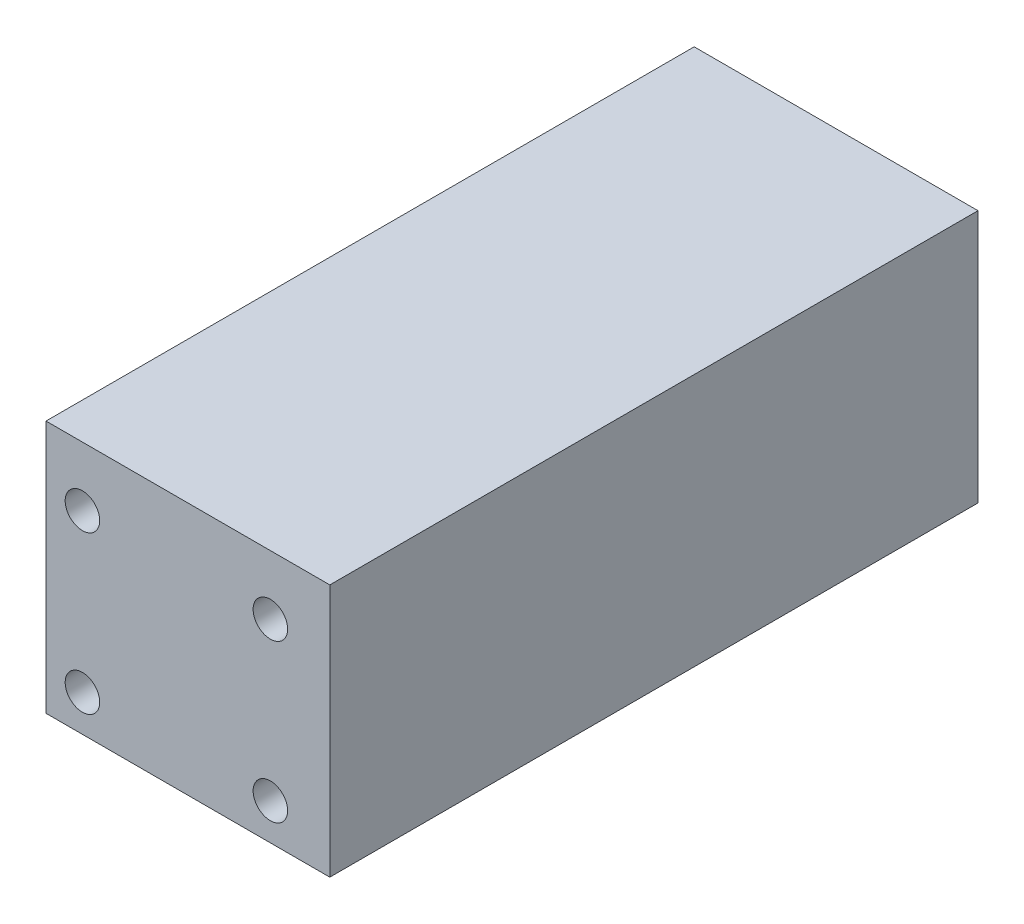
from build123d import *

# Parameters (mm, degrees)
SKETCH1_W           = 34
SKETCH1_H           = 30
SKETCH1_R           = 2.25
BOSS_EXTRUDE1_DEPTH = 5
SKETCH2_W           = 5
SKETCH2_H           = 30
BOSS_EXTRUDE2_DEPTH = 15
SKETCH4_W           = 5
SKETCH4_H           = 30
BOSS_EXTRUDE3_DEPTH = 25
SKETCH5_R           = 2.5
CUT_EXTRUDE1_DEPTH  = 25
SKETCH6_W           = 15
SKETCH6_H           = 30
CUT_EXTRUDE2_DEPTH  = 66
SKETCH7_W           = 34
SKETCH7_H           = 30
SKETCH7_R           = 2.25
BOSS_EXTRUDE4_DEPTH = 79.5
SKETCH8_W           = 34
SKETCH8_H           = 74.5
CUT_EXTRUDE3_DEPTH  = 30
BOSS_EXTRUDE6_DEPTH = 84.5


with BuildPart() as part:
    # Sketch1 → Boss-Extrude1 (new body)
    with BuildSketch(Plane.XY):
        with Locations((17, 15)):
            Rectangle(SKETCH1_W, SKETCH1_H)
        with Locations((4.75, 25.25)):
            Circle(SKETCH1_R, mode=Mode.SUBTRACT)
        with Locations((29.25, 25.25)):
            Circle(SKETCH1_R, mode=Mode.SUBTRACT)
        with Locations((29.25, 4.75)):
            Circle(SKETCH1_R, mode=Mode.SUBTRACT)
        with Locations((4.75, 4.75)):
            Circle(SKETCH1_R, mode=Mode.SUBTRACT)
    extrude(amount=BOSS_EXTRUDE1_DEPTH)

    # Sketch2 → Boss-Extrude2 (add)
    with BuildSketch(Plane.ZY):
        with Locations((2.5, 15)):
            Rectangle(SKETCH2_W, SKETCH2_H)
    extrude(amount=BOSS_EXTRUDE2_DEPTH)

    # Sketch4 → Boss-Extrude3 (add)
    with BuildSketch(Plane.XY.offset(5)):
        with Locations((-12.5, 15)):
            Rectangle(SKETCH4_W, SKETCH4_H)
    extrude(amount=BOSS_EXTRUDE3_DEPTH)

    # Sketch5 → Cut-Extrude1 (cut)
    with BuildSketch(Plane(origin=(-10, 0, 0), x_dir=(0, 0, -1), z_dir=(1, 0, 0))):
        with Locations((-24, 15)):
            Circle(SKETCH5_R)
        with Locations((-10, 15)):
            Circle(SKETCH5_R)
    extrude(amount=-CUT_EXTRUDE1_DEPTH, mode=Mode.SUBTRACT)

    # Sketch6 → Cut-Extrude2 (cut)
    with BuildSketch(Plane(origin=(0, 30, 0), x_dir=(1, 0, 0), z_dir=(0, 1, 0))):
        with Locations((-7.5, -15)):
            Rectangle(SKETCH6_W, SKETCH6_H)
    extrude(amount=-CUT_EXTRUDE2_DEPTH, mode=Mode.SUBTRACT)

    # Sketch7 → Boss-Extrude4 (add)
    with BuildSketch(Plane.XY.offset(5)):
        with Locations((17, 15)):
            Rectangle(SKETCH7_W, SKETCH7_H)
        with Locations((4.75, 25.25)):
            Circle(SKETCH7_R, mode=Mode.SUBTRACT)
        with Locations((29.25, 25.25)):
            Circle(SKETCH7_R, mode=Mode.SUBTRACT)
        with Locations((29.25, 4.75)):
            Circle(SKETCH7_R, mode=Mode.SUBTRACT)
        with Locations((4.75, 4.75)):
            Circle(SKETCH7_R, mode=Mode.SUBTRACT)
    extrude(amount=BOSS_EXTRUDE4_DEPTH)

    # Sketch8 → Cut-Extrude3 (cut)
    with BuildSketch(Plane(origin=(0, 30, 0), x_dir=(1, 0, 0), z_dir=(0, 1, 0))):
        with Locations((17, -42.25)):
            Rectangle(SKETCH8_W, SKETCH8_H)
    extrude(amount=-CUT_EXTRUDE3_DEPTH, mode=Mode.SUBTRACT)


with BuildPart() as cut_extrude3_piece_1:
    # of the separate pieces the step leaves, piece 1, a body of its own (cut_extrude3_pieces)
    add(part.part.solids().sort_by_distance((34, 0, 0))[0])



with BuildPart() as cut_extrude3_piece_2:
    # of the separate pieces the step leaves, piece 2, a body of its own (cut_extrude3_pieces)
    add(part.part.solids().sort_by_distance((34, 0, 79.5))[0])


with BuildPart() as cut_extrude3_piece_1_1:
    add(cut_extrude3_piece_1.part)

    add(cut_extrude3_piece_2.part)  # Boss-Extrude6 merges Cut-Extrude3 piece 2
    # Sketch11 → Boss-Extrude6 (add)
    with BuildSketch(Plane(origin=(0, 0, 0), x_dir=(-1, 0, 0), z_dir=(0, 0, -1))):
        Polygon((0, 30), (0, 33), (-37, 33), (-37, 0), (-34, 0), (-34, 30), align=None)
    extrude(amount=-BOSS_EXTRUDE6_DEPTH)


solid = cut_extrude3_piece_1_1.part
